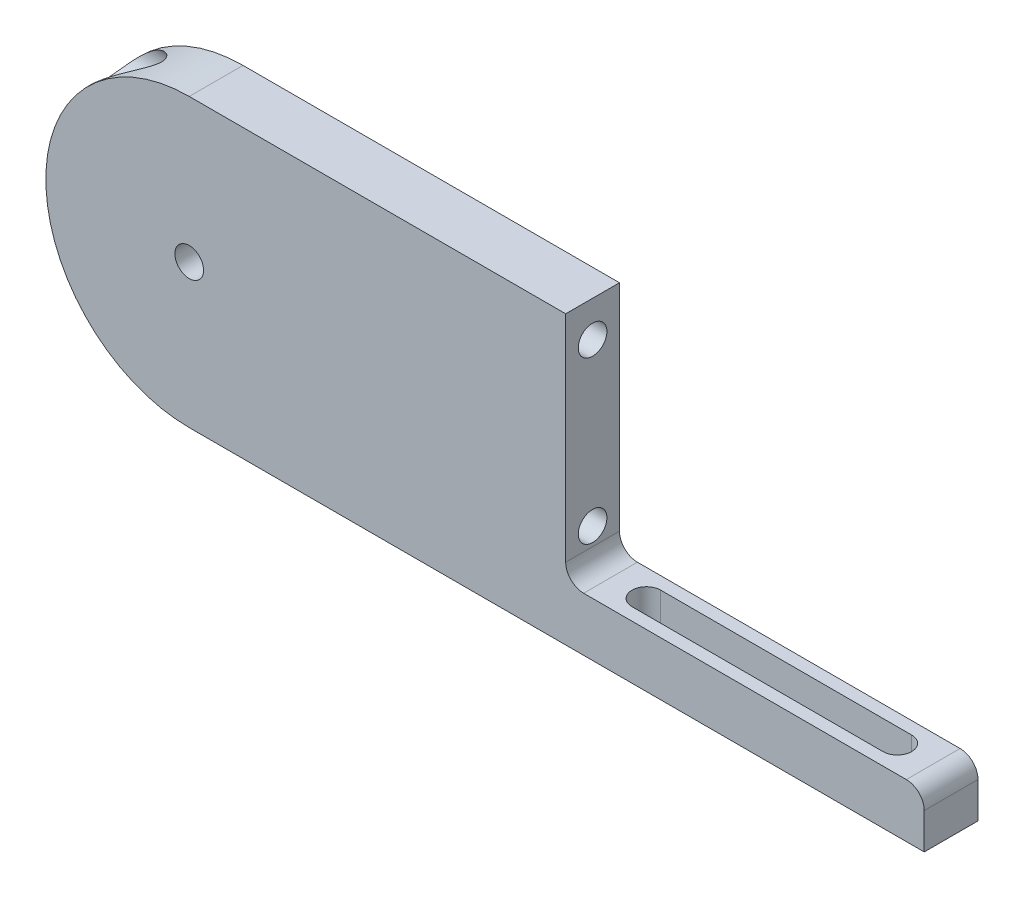
from build123d import *

# Parameters (mm, degrees)
ESTRUSIONE1_DEPTH        = 7.5
SCHIZZO2_R               = 4
TAGLIO_ESTRUSIONE1_DEPTH = 15
SCHIZZO4_R               = 6.75
TAGLIO_ESTRUSIONE3_DEPTH = 8.5
SCHIZZO11_W              = 15
SCHIZZO11_H              = 15
ESTRUSIONE3_DEPTH        = 100
RACCORDO2_R              = 5
SCHIZZO13_R              = 4
TAGLIO_ESTRUSIONE4_DEPTH = 151.602954818
SCHIZZO14_R              = 7
TAGLIO_ESTRUSIONE5_DEPTH = 132.458168383
TAGLIO_ESTRUSIONE6_DEPTH = 100


with BuildPart() as part:
    # Schizzo1 → Estrusione1 (new, symmetric)
    with BuildSketch(Plane.XY):
        with BuildLine():
            Line((0, 40), (105, 40))
            Line((105, 40), (105, -40))
            Line((105, -40), (0, -40))
            ThreePointArc((0, -40), (-40, 0), (0, 40))
        make_face()
    extrude(amount=ESTRUSIONE1_DEPTH, both=True)

    # Schizzo2 → Taglio-Estrusione1 (cut)
    with BuildSketch(Plane.XY.offset(7.5)):
        Circle(SCHIZZO2_R)
    extrude(amount=-TAGLIO_ESTRUSIONE1_DEPTH, mode=Mode.SUBTRACT)

    # Schizzo4 → Taglio-Estrusione3 (cut)
    with BuildSketch(Plane.XY.offset(-7.5)):
        Circle(SCHIZZO4_R)
    extrude(amount=TAGLIO_ESTRUSIONE3_DEPTH, mode=Mode.SUBTRACT)

    # Schizzo11 → Estrusione3 (add)
    with BuildSketch(Plane(origin=(105, 0, 0), x_dir=(0, 0, -1), z_dir=(1, 0, 0))):
        with Locations((0, -32.5)):
            Rectangle(SCHIZZO11_W, SCHIZZO11_H)
    extrude(amount=ESTRUSIONE3_DEPTH)

    # Raccordo2
    raccordo2_edges = [part.edges().sort_by_distance(p)[0] for p in [
        (105, -25, 0),
        (205, -25, 0),
    ]]
    fillet(raccordo2_edges, radius=RACCORDO2_R)

    # Schizzo13 → Taglio-Estrusione4 (cut, through all)
    with BuildSketch(Plane(origin=(105, 0, 0), x_dir=(0, 0, -1), z_dir=(1, 0, 0))):
        with Locations((0, -15)):
            Circle(SCHIZZO13_R)
        with Locations((0, 30)):
            Circle(SCHIZZO13_R)
    extrude(amount=-TAGLIO_ESTRUSIONE4_DEPTH, mode=Mode.SUBTRACT)

    # Schizzo14 → Taglio-Estrusione5 (cut, through all)
    with BuildSketch(Plane(origin=(85, 0, 0), x_dir=(0, 0, -1), z_dir=(1, 0, 0))):
        with Locations((0, 30)):
            Circle(SCHIZZO14_R)
        with Locations((0, -15)):
            Circle(SCHIZZO14_R)
    extrude(amount=-TAGLIO_ESTRUSIONE5_DEPTH, mode=Mode.SUBTRACT)

    # Schizzo15 → Taglio-Estrusione6 (cut)
    with BuildSketch(Plane.XZ.offset(40)):
        with BuildLine():
            Line((120, 4), (190, 4))
            ThreePointArc((190, 4), (194, 0), (190, -4))
            Line((190, -4), (120, -4))
            ThreePointArc((120, -4), (116, 0), (120, 4))
        make_face()
    extrude(amount=-TAGLIO_ESTRUSIONE6_DEPTH, mode=Mode.SUBTRACT)


solid = part.part
